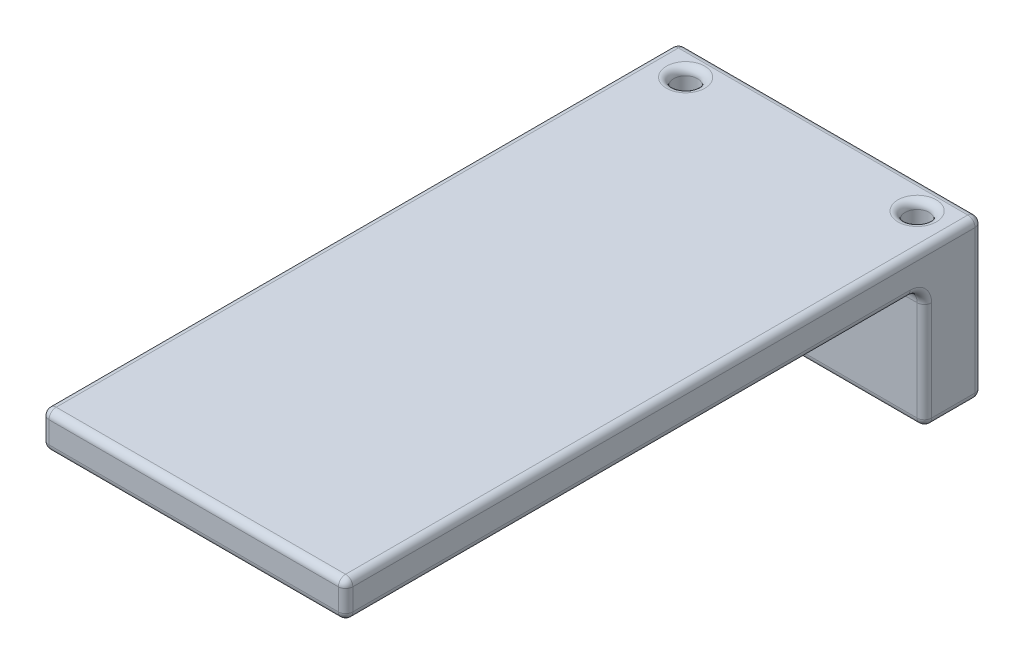
from build123d import *

# Parameters (mm, degrees)
SKETCH1_W           = 42
SKETCH1_H           = 80
BOSS_EXTRUDE1_DEPTH = 5
SKETCH2_W           = 42
SKETCH2_H           = 8
SKETCH2_R           = 1.65
BOSS_EXTRUDE2_DEPTH = 21.8
FILLET1_R           = 2
FILLET2_R           = 1


with BuildPart() as part:
    # Sketch1 → Boss-Extrude1 (new body)
    with BuildSketch(Plane(origin=(0, 0, 0), x_dir=(1, 0, 0), z_dir=(0, 1, 0))):
        Rectangle(SKETCH1_W, SKETCH1_H)
    extrude(amount=BOSS_EXTRUDE1_DEPTH)

    # Sketch2 → Boss-Extrude2 (add)
    with BuildSketch(Plane(origin=(0, 5, 0), x_dir=(1, 0, 0), z_dir=(0, 1, 0))):
        with Locations((0, 44)):
            Rectangle(SKETCH2_W, SKETCH2_H)
        with Locations(Location((16, 44, 0), (0, 0, 270))):
            Circle(SKETCH2_R, mode=Mode.SUBTRACT)
        with Locations(Location((-16, 44, 0), (0, 0, 270))):
            Circle(SKETCH2_R, mode=Mode.SUBTRACT)
    extrude(amount=-BOSS_EXTRUDE2_DEPTH)

    # Fillet1
    fillet1_edges = [part.edges().sort_by_distance(p)[0] for p in [
        (0, 0, -40),
    ]]
    fillet(fillet1_edges, radius=FILLET1_R)

    # Fillet2
    fillet2_edges = [part.edges().sort_by_distance(p)[0] for p in [
        (-21, 5, -4),
        (21, -9.4, -40),
        (21, -5.9, -48),
        (-21, -5.9, -48),
        (-21, -9.4, -40),
        (16, -16.8, -45.65),
        (16, 5, -45.65),
        (0, 5, -48),
        (-16, -16.8, -45.65),
        (-16, 5, -45.65),
        (0, 5, 40),
        (-21, -16.8, -44),
        (0, -16.8, -48),
        (21, -16.8, -44),
        (0, -16.8, -40),
        (-21, 0, 1),
        (-21, -0.585786438, -39.414213562),
        (21, -0.585786438, -39.414213562),
        (21, 5, -4),
        (0, 0, 40),
        (21, 0, 1),
        (21, 2.5, 40),
        (-21, 2.5, 40),
    ]]
    fillet(fillet2_edges, radius=FILLET2_R)


solid = part.part
